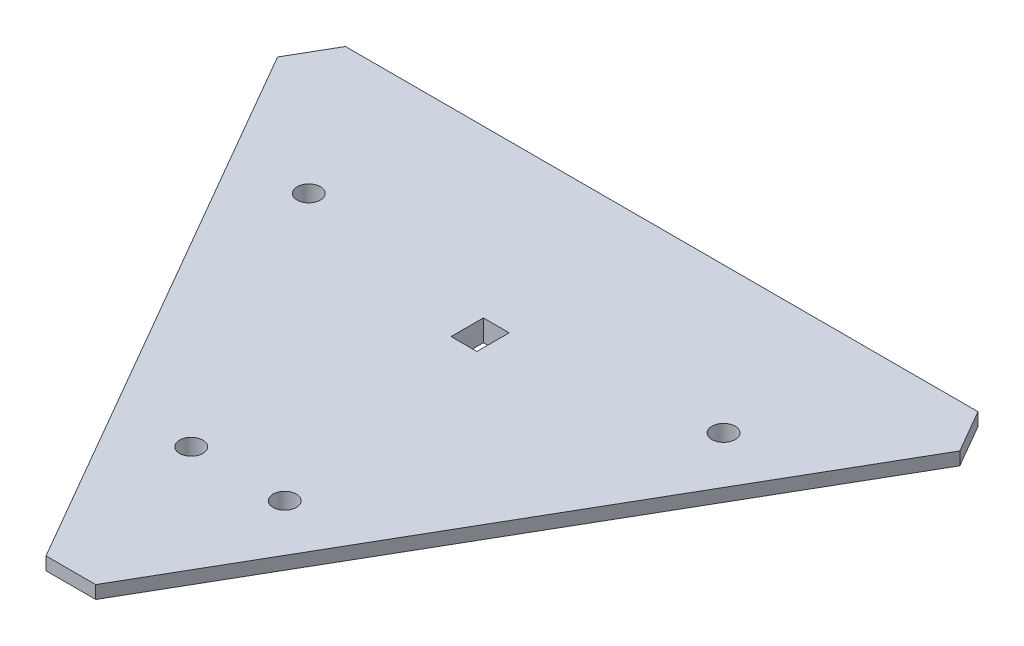
from build123d import *

# Parameters (mm, degrees)
SKETCH1_R           = 45.957081427
BOSS_EXTRUDE1_DEPTH = 2
BOSS_EXTRUDE2_DEPTH = 3
SKETCH3_R           = 2.7
CUT_EXTRUDE1_DEPTH  = 119.626220937
SKETCH5_W           = 16
SKETCH5_H           = 2
CUT_EXTRUDE2_DEPTH  = 4
SKETCH6_W           = 6
SKETCH6_H           = 7.5
CUT_EXTRUDE3_DEPTH  = 67


with BuildPart() as part:
    # Sketch1 → Boss-Extrude1 (new body)
    with BuildSketch(Plane(origin=(0, 0, 0), x_dir=(1, 0, 0), z_dir=(0, 1, 0))):
        with BuildLine():
            Line((-1.88e-07, 45.957081427), (-60, 45.957081427))
            Line((-60, 45.957081427), (-69.8, 28.982983513))
            Line((-69.8, 28.982983513), (-39.800000841, -22.978539257))
            ThreePointArc((-39.800000841, -22.978539257), (-39.799999627, 22.97854136), (-1.88e-07, 45.957081427))
        make_face()
        Circle(SKETCH1_R)
        with BuildLine():
            Line((60, 45.957081427), (-1.88e-07, 45.957081427))
            ThreePointArc((-1.88e-07, 45.957081427), (32.496563854, 32.496563988), (45.957081427, 0))
            ThreePointArc((45.957081427, 0), (44.391132009, -11.894567342), (39.80000061, -22.978539658))
            Line((39.80000061, -22.978539658), (69.8, 28.982983513))
            Line((69.8, 28.982983513), (60, 45.957081427))
        make_face()
        with BuildLine():
            ThreePointArc((39.80000061, -22.978539658), (-2.31e-07, -45.957081427), (-39.800000841, -22.978539257))
            Line((-39.800000841, -22.978539257), (-9.8, -74.940064941))
            Line((-9.8, -74.940064941), (9.8, -74.940064941))
            Line((9.8, -74.940064941), (39.80000061, -22.978539658))
        make_face()
    extrude(amount=BOSS_EXTRUDE1_DEPTH)

    # Sketch2 → Boss-Extrude2 (add)
    with BuildSketch(Plane(origin=(0, 2, 0), x_dir=(1, 0, 0), z_dir=(0, 1, 0))):
        Polygon((-73.452994616, 49.074772881), (-79.226497308, 39.074772881), (-5.773502692, -88.149545762), (5.773502692, -88.149545762), (79.226497308, 39.074772881), (73.452994616, 49.074772881), align=None)
    extrude(amount=BOSS_EXTRUDE2_DEPTH)

    # Sketch3 → Cut-Extrude1 (cut, through all)
    with BuildSketch(Plane(origin=(0, 0, 0), x_dir=(1, 0, 0), z_dir=(0, 1, 0))):
        with Locations(Location((-48.161138908, 15.267993776, 0), (0, 0, 270))):
            Circle(SKETCH3_R)
        with Locations(Location((-10.858098979, -49.342766658, 0), (0, 0, 270))):
            Circle(SKETCH3_R)
        with Locations(Location((10.858098979, -49.342766658, 0), (0, 0, 90))):
            Circle(SKETCH3_R)
        with Locations(Location((48.161138908, 15.267993776, 0), (0, 0, 90))):
            Circle(SKETCH3_R)
    extrude(amount=CUT_EXTRUDE1_DEPTH, mode=Mode.SUBTRACT)

    # Sketch5 → Cut-Extrude2 (cut)
    with BuildSketch(Plane.XZ):
        with Locations((0, -1)):
            Rectangle(SKETCH5_W, SKETCH5_H)
    extrude(amount=-CUT_EXTRUDE2_DEPTH, mode=Mode.SUBTRACT)

    # Sketch6 → Cut-Extrude3 (cut)
    with BuildSketch(Plane.XZ):
        with Locations((0.15, -6.75)):
            Rectangle(SKETCH6_W, SKETCH6_H)
    extrude(amount=-CUT_EXTRUDE3_DEPTH, mode=Mode.SUBTRACT)


solid = part.part
